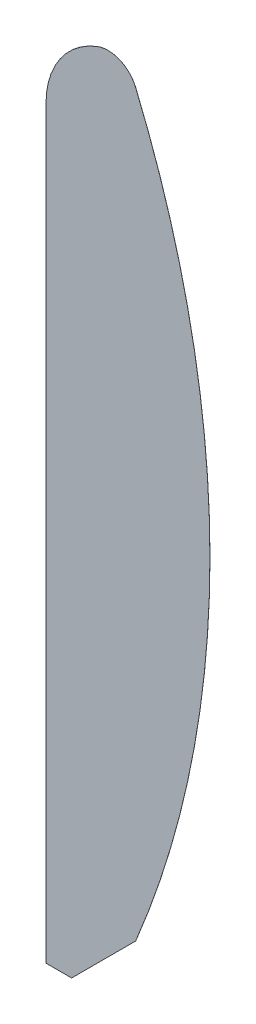
from build123d import *

# Parameters (mm, degrees)
BOSS_EXTRUDE1_DEPTH = 0.01


with BuildPart() as part:
    # Sketch1 → Boss-Extrude1 (new body)
    with BuildSketch(Plane(origin=(0, 0, 0), x_dir=(0, 1, 0), z_dir=(0, 0, 1))):
        with BuildLine():
            Line((0, 0), (145.44, 0))
            ThreePointArc((145.44, 0), (154.271670284, -2.740768067), (160, -10))
            ThreePointArc((160, -10), (159.920065515, -14.399330878), (156.798150608, -17.5))
            ThreePointArc((156.798150608, -17.5), (84.649075304, -32), (12.5, -17.5))
            Line((12.5, -17.5), (0, -5))
            Line((0, -5), (0, 0))
        make_face()
    extrude(amount=BOSS_EXTRUDE1_DEPTH)


solid = part.part
